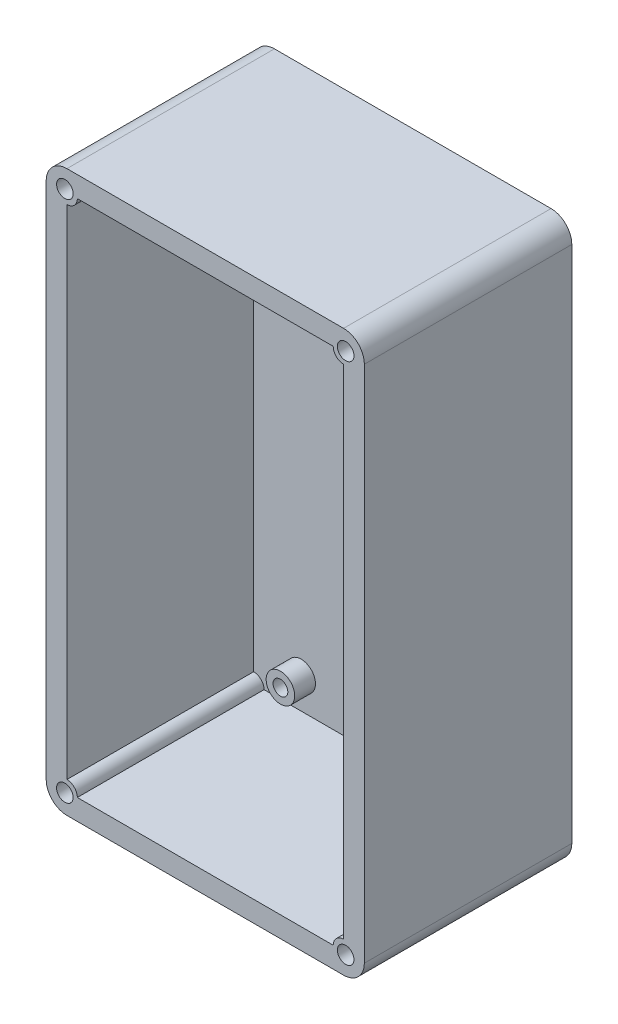
from build123d import *

# Parameters (mm, degrees)
SKETCH1_W           = 40
SKETCH1_H           = 75
SKETCH1_R           = 1.065
BOSS_EXTRUDE1_DEPTH = 3
SKETCH2_R           = 2.065
SKETCH2_R_2         = 1.065
BOSS_EXTRUDE2_DEPTH = 3
SKETCH4_W           = 46
SKETCH4_H           = 81
BOSS_EXTRUDE3_DEPTH = 30
SKETCH5_W           = 8
SKETCH5_H           = 12
CUT_EXTRUDE1_DEPTH  = 25
FILLET2_R           = 2
SKETCH6_R           = 1.2
CUT_EXTRUDE2_DEPTH  = 20
SKETCH7_R           = 1.65
CUT_EXTRUDE3_DEPTH  = 20
SKETCH8_R           = 2.5
CUT_EXTRUDE4_DEPTH  = 2.5
FILLET3_R           = 3


with BuildPart() as part:
    # Sketch1 → Boss-Extrude1 (new body)
    with BuildSketch(Plane.XY):
        Rectangle(SKETCH1_W, SKETCH1_H)
        with Locations((13.13, 33.06)):
            Circle(SKETCH1_R, mode=Mode.SUBTRACT)
        with Locations(Location((-13.13, 33.06, 0), (0, 0, 180))):
            Circle(SKETCH1_R, mode=Mode.SUBTRACT)
        with Locations((-13.13, -33.06)):
            Circle(SKETCH1_R, mode=Mode.SUBTRACT)
        with Locations(Location((13.13, -33.06, 0), (0, 0, 180))):
            Circle(SKETCH1_R, mode=Mode.SUBTRACT)
    extrude(amount=BOSS_EXTRUDE1_DEPTH)

    # Sketch2 → Boss-Extrude2 (add)
    # profile 1 of 4: a face of its own
    with BuildSketch(Plane.XY.offset(3)):
        with Locations(Location((-13.13, 33.06, 0), (0, 0, 180))):
            Circle(SKETCH2_R)
        with Locations(Location((-13.13, 33.06, 0), (0, 0, 180))):
            Circle(SKETCH2_R_2, mode=Mode.SUBTRACT)
    # profile 2 of 4: a face of its own
    with BuildSketch(Plane.XY.offset(3)):
        with Locations(Location((13.13, 33.06, 0), (0, 0, 180))):
            Circle(SKETCH2_R)
        with Locations(Location((13.13, 33.06, 0), (0, 0, 180))):
            Circle(SKETCH2_R_2, mode=Mode.SUBTRACT)
    # profile 3 of 4: a face of its own
    with BuildSketch(Plane.XY.offset(3)):
        with Locations(Location((13.13, -33.06, 0), (0, 0, 180))):
            Circle(SKETCH2_R)
        with Locations(Location((13.13, -33.06, 0), (0, 0, 180))):
            Circle(SKETCH2_R_2, mode=Mode.SUBTRACT)
    # profile 4 of 4: a face of its own
    with BuildSketch(Plane.XY.offset(3)):
        with Locations(Location((-13.13, -33.06, 0), (0, 0, 180))):
            Circle(SKETCH2_R)
        with Locations(Location((-13.13, -33.06, 0), (0, 0, 180))):
            Circle(SKETCH2_R_2, mode=Mode.SUBTRACT)
    extrude(amount=BOSS_EXTRUDE2_DEPTH)

    # Sketch4 → Boss-Extrude3 (add)
    with BuildSketch(Plane(origin=(0, 0, 0), x_dir=(-1, 0, 0), z_dir=(0, 0, -1))):
        Rectangle(SKETCH4_W, SKETCH4_H)
        with BuildLine():
            Line((-18.5, -37.5), (18.5, -37.5))
            ThreePointArc((18.5, -37.5), (18.939339828, -36.439339828), (20, -36))
            Line((20, -36), (20, 36))
            ThreePointArc((20, 36), (18.939339828, 36.439339828), (18.5, 37.5))
            Line((18.5, 37.5), (-18.5, 37.5))
            ThreePointArc((-18.5, 37.5), (-18.939339828, 36.439339828), (-20, 36))
            Line((-20, 36), (-20, -36))
            ThreePointArc((-20, -36), (-18.939339828, -36.439339828), (-18.5, -37.5))
        make_face(mode=Mode.SUBTRACT)
    extrude(amount=-BOSS_EXTRUDE3_DEPTH)

    # Sketch5 → Cut-Extrude1 (cut)
    with BuildSketch(Plane.XY.offset(3)):
        Rectangle(SKETCH5_W, SKETCH5_H)
    extrude(amount=-CUT_EXTRUDE1_DEPTH, mode=Mode.SUBTRACT)

    # Fillet2
    fillet2_edges = [part.edges().sort_by_distance(p)[0] for p in [
        (4, 6, 1.5),
        (4, -6, 1.5),
        (-4, -6, 1.5),
        (-4, 6, 1.5),
    ]]
    fillet(fillet2_edges, radius=FILLET2_R)

    # Sketch6 → Cut-Extrude2 (cut)
    with BuildSketch(Plane.XY.offset(30)):
        with Locations((-20.3, 37.8)):
            Circle(SKETCH6_R)
        with Locations(Location((20.3, 37.8, 0), (0, 0, 180))):
            Circle(SKETCH6_R)
        with Locations((20.3, -37.8)):
            Circle(SKETCH6_R)
        with Locations(Location((-20.3, -37.8, 0), (0, 0, 180))):
            Circle(SKETCH6_R)
    extrude(amount=-CUT_EXTRUDE2_DEPTH, mode=Mode.SUBTRACT)

    # Sketch7 → Cut-Extrude3 (cut)
    with BuildSketch(Plane.XY.offset(3)):
        with Locations((0, 18.75)):
            Circle(SKETCH7_R)
        with Locations(Location((0, -18.75, 0), (0, 0, 180))):
            Circle(SKETCH7_R)
    extrude(amount=-CUT_EXTRUDE3_DEPTH, mode=Mode.SUBTRACT)

    # Sketch8 → Cut-Extrude4 (cut)
    with BuildSketch(Plane.XY.offset(3)):
        with Locations((0, 18.75)):
            Circle(SKETCH8_R)
        with Locations((0, -18.75)):
            Circle(SKETCH8_R)
    extrude(amount=-CUT_EXTRUDE4_DEPTH, mode=Mode.SUBTRACT)

    # Fillet3
    fillet3_edges = [part.edges().sort_by_distance(p)[0] for p in [
        (-23, 40.5, 15),
        (-23, -40.5, 15),
        (23, -40.5, 15),
        (23, 40.5, 15),
    ]]
    fillet(fillet3_edges, radius=FILLET3_R)


solid = part.part
